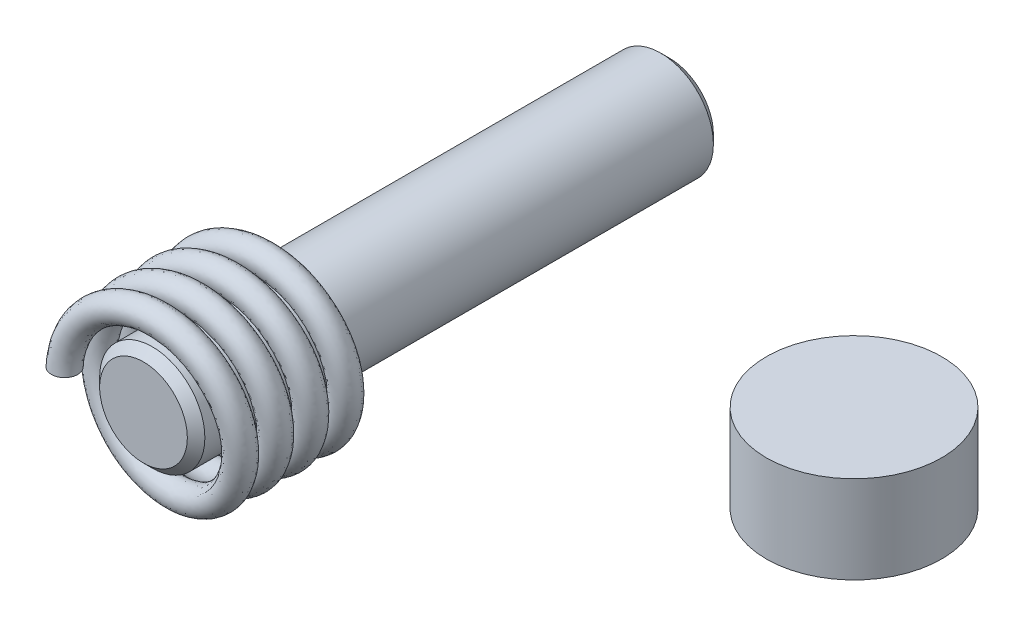
from build123d import *

# Parameters (mm, degrees)
SKETCH1_R           = 0.6
BOSS_EXTRUDE1_DEPTH = 3
CHAMFER1_SIZE       = 0.1
SKETCH2_R           = 1
BOSS_EXTRUDE2_DEPTH = 1
SWEEP2_PITCH        = 0.4
SWEEP2_HEIGHT       = 1.5
SWEEP2_RADIUS       = 0.9
SKETCH7_R           = 0.15


with BuildPart() as part:
    # Sketch1 → Boss-Extrude1 (new, symmetric)
    with BuildSketch(Plane.XY):
        Circle(SKETCH1_R)
    extrude(amount=BOSS_EXTRUDE1_DEPTH, both=True)

    # Chamfer1
    chamfer1_edges = [part.edges().sort_by_distance(p)[0] for p in [
        (-0.6, 0, -3),
        (-0.6, 0, 3),
    ]]
    chamfer(chamfer1_edges, length=CHAMFER1_SIZE)


with BuildPart() as body_2:
    # Sketch2 → Boss-Extrude2 (new body)
    with BuildSketch(Plane(origin=(0, 0, 0), x_dir=(1, 0, 0), z_dir=(0, 1, 0))):
        with Locations(Location((5, 0.104076317, 0), (0, 0, 270))):
            Circle(SKETCH2_R)
    extrude(amount=BOSS_EXTRUDE2_DEPTH)


with BuildPart() as body_3:
    # Sweep2: sweep along a helix
    with BuildLine() as sweep2_path:
        Helix(SWEEP2_PITCH, SWEEP2_HEIGHT, SWEEP2_RADIUS, center=(0, 0, 3), direction=(0, 0, -1))
    # Sketch7 → Sweep2 (sweep)
    with BuildSketch(Plane(origin=(0, 0, 0), x_dir=(0, 0, -1), z_dir=(1, 0, 0))):
        with Locations((-1.5, -0.9)):
            Circle(SKETCH7_R)
    sweep(path=sweep2_path.line, is_frenet=True)


solid = Compound([part.part, body_2.part, body_3.part])
